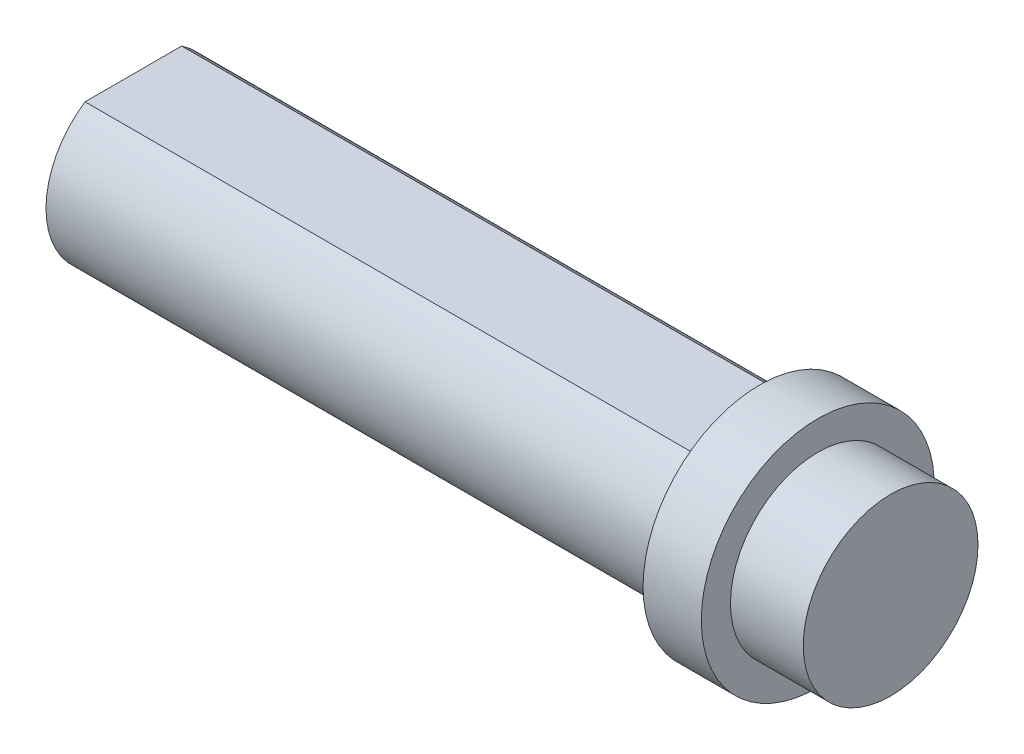
from build123d import *

# Parameters (mm, degrees)
SKETCH1_R           = 3
BOSS_EXTRUDE1_DEPTH = 26
CUT_EXTRUDE1_DEPTH  = 21.5
SKETCH3_R           = 4
SKETCH3_R_2         = 3
BOSS_EXTRUDE2_DEPTH = 2
BOSS_EXTRUDE3_DEPTH = 1.66


with BuildPart() as part:
    # Sketch1 → Boss-Extrude1 (new body)
    with BuildSketch(Plane(origin=(0, 0, 0), x_dir=(0, 0, -1), z_dir=(1, 0, 0))):
        with Locations(Location((0, 0, 0), (0, 0, 180))):
            Circle(SKETCH1_R)
    extrude(amount=BOSS_EXTRUDE1_DEPTH)

    # Sketch2 → Cut-Extrude1 (cut)
    with BuildSketch(Plane.ZY):
        with BuildLine():
            Line((-1.658312395, 2.5), (1.658312395, 2.5))
            ThreePointArc((1.658312395, 2.5), (0, 3), (-1.658312395, 2.5))
        make_face()
    extrude(amount=-CUT_EXTRUDE1_DEPTH, mode=Mode.SUBTRACT)

    # Sketch3 → Boss-Extrude2 (add)
    with BuildSketch(Plane.ZY.offset(-21.5)):
        Circle(SKETCH3_R)
        Circle(SKETCH3_R_2, mode=Mode.SUBTRACT)
    extrude(amount=-BOSS_EXTRUDE2_DEPTH)

    # Sketch4 → Boss-Extrude3 (add, symmetric)
    with BuildSketch(Plane.XY):
        Polygon((21, 2.5), (21.5, 2.75), (21.5, 2.5), align=None)
    extrude(amount=BOSS_EXTRUDE3_DEPTH, both=True)


solid = part.part
